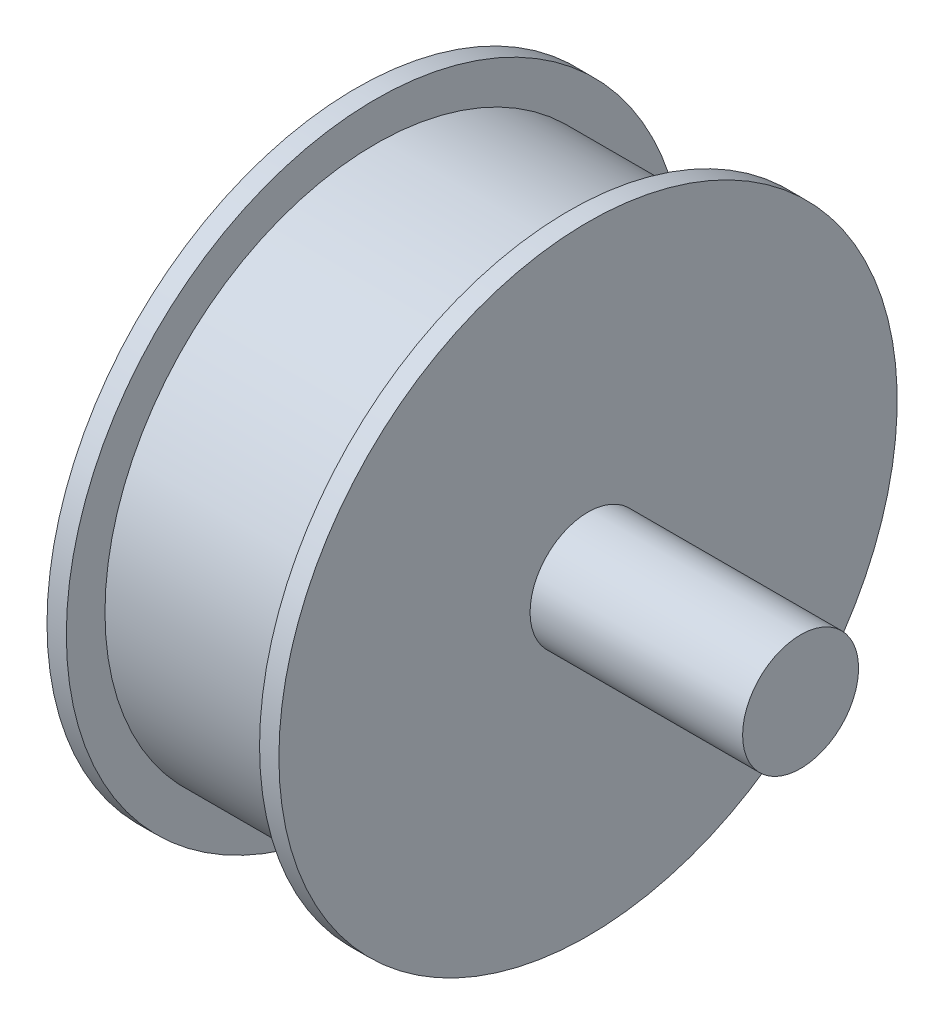
from build123d import *

# Parameters (mm, degrees)
FILLET1_R = 1


with BuildPart() as part:
    # Sketch1 → Revolve1 (revolve)
    with BuildSketch(Plane.XY, mode=Mode.PRIVATE) as revolve1_sk:
        Polygon((0, 7.5), (0, 40), (-2.5, 40), (-2.5, 35), (-27.5, 35), (-27.5, 40), (-30, 40), (-30, 30), (-25, 30), (-25, 10), (-30, 10), (-30, 5), (-27.5, 5), (-27.5, 0), (27.5, 0), (27.5, 7.5), align=None)
    revolve(revolve1_sk.sketch.rotate(Axis((-27.5, 0, 0), (1, 0, 0)), 90), axis=Axis((-27.5, 0, 0), (1, 0, 0)))

    # Fillet1
    fillet1_edges = [part.edges().sort_by_distance(p)[0] for p in [
        (-30, 0, -10),
    ]]
    fillet(fillet1_edges, radius=FILLET1_R)


solid = part.part
